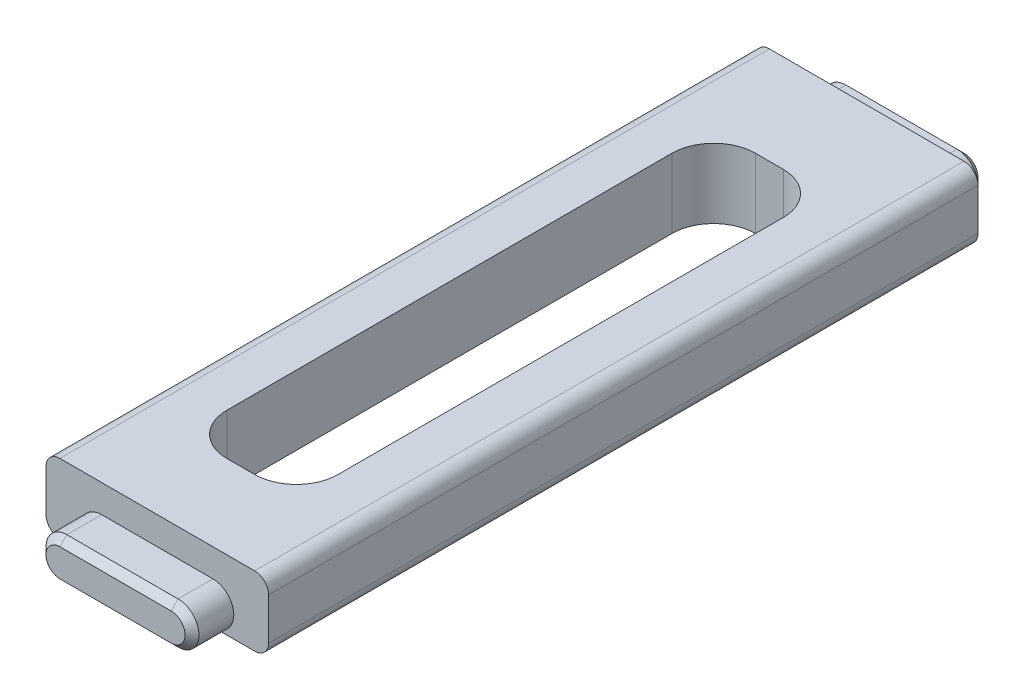
from build123d import *

# Parameters (mm, degrees)
EXTRUDE_1_DEPTH     = 3
SKETCH_2_W          = 16
SKETCH_2_H          = 5
EXTRUDE_2_DEPTH     = 51
EXTRUDE_START       = 3
EXTRUDE_3_DEPTH     = 3
FILLET_1_R          = 1
CHAMFER_1_SIZE      = 0.5
SKETCH_4_W          = 8
SKETCH_4_H          = 38
CUT_EXTRUDE_1_DEPTH = 55.817880295
FILLET_2_R          = 3


with BuildPart() as part:
    # 草图1 → 凸台-拉伸1 (new body)
    with BuildSketch(Plane.XY):
        with BuildLine():
            Line((-4, 1.5), (4, 1.5))
            ThreePointArc((4, 1.5), (5.5, 0), (4, -1.5))
            Line((4, -1.5), (-4, -1.5))
            ThreePointArc((-4, -1.5), (-5.5, 0), (-4, 1.5))
        make_face()
    extrude(amount=EXTRUDE_1_DEPTH)

    # 草图2 → 凸台-拉伸2 (add)
    with BuildSketch(Plane(origin=(0, 0, 0), x_dir=(-1, 0, 0), z_dir=(0, 0, -1))):
        with Locations((0, 1)):
            Rectangle(SKETCH_2_W, SKETCH_2_H)
    extrude(amount=EXTRUDE_2_DEPTH)

    # 草图3 → 凸台-拉伸3 (add)
    with BuildSketch(Plane(origin=(0, 0, -51), x_dir=(-1, 0, 0), z_dir=(0, 0, -1)).offset(EXTRUDE_START)):
        with BuildLine():
            Line((-4, 1.5), (4, 1.5))
            ThreePointArc((4, 1.5), (5.5, 0), (4, -1.5))
            Line((4, -1.5), (-4, -1.5))
            ThreePointArc((-4, -1.5), (-5.5, 0), (-4, 1.5))
        make_face()
    extrude(amount=-EXTRUDE_3_DEPTH)

    # 圆角1
    fillet_1_edges = [part.edges().sort_by_distance(p)[0] for p in [
        (-8, -1.5, -25.5),
        (-8, 3.5, -25.5),
        (8, 3.5, -25.5),
        (8, -1.5, -25.5),
    ]]
    fillet(fillet_1_edges, radius=FILLET_1_R)

    # 倒角1
    chamfer_1_edges = [part.edges().sort_by_distance(p)[0] for p in [
        (5.5, 0, 3),
        (0, 1.5, 3),
        (5.5, 0, -54),
        (0, -1.5, -54),
        (-5.5, 0, -54),
        (0, 1.5, -54),
        (-5.5, 0, 3),
        (0, -1.5, 3),
    ]]
    chamfer(chamfer_1_edges, length=CHAMFER_1_SIZE)

    # 草图4 → 切除-拉伸1 (cut, through all)
    with BuildSketch(Plane.XZ.offset(1.5)):
        with Locations((0, -25)):
            Rectangle(SKETCH_4_W, SKETCH_4_H)
    extrude(amount=-CUT_EXTRUDE_1_DEPTH, mode=Mode.SUBTRACT)

    # 圆角2
    fillet_2_edges = [part.edges().sort_by_distance(p)[0] for p in [
        (4, 1, -6),
        (4, 1, -44),
        (-4, 1, -44),
        (-4, 1, -6),
    ]]
    fillet(fillet_2_edges, radius=FILLET_2_R)


solid = part.part
